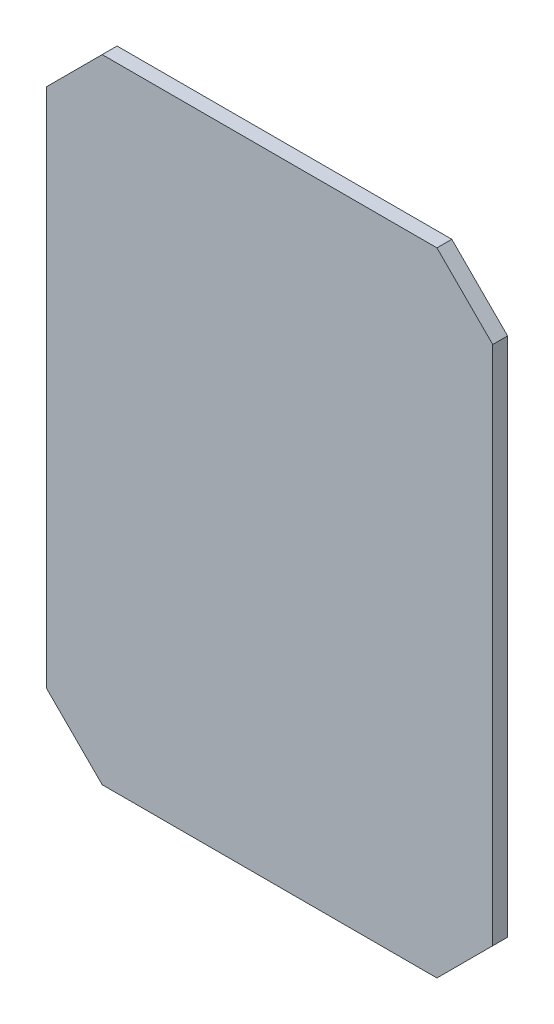
from build123d import *

# Parameters (mm, degrees)
EXTRUDE_1_DEPTH = 8


with BuildPart() as part:
    # 草图1 → 凸台-拉伸1 (new body)
    with BuildSketch(Plane.XY):
        Polygon((-95.907877066, 78.020587946), (-65.907877066, 108.020587946), (114.092122934, 108.020587946), (144.092122934, 78.020587946), (144.092122934, -201.979412054), (114.092122934, -231.979412054), (-65.907877066, -231.979412054), (-95.907877066, -201.979412054), align=None)
    extrude(amount=EXTRUDE_1_DEPTH)


solid = part.part
